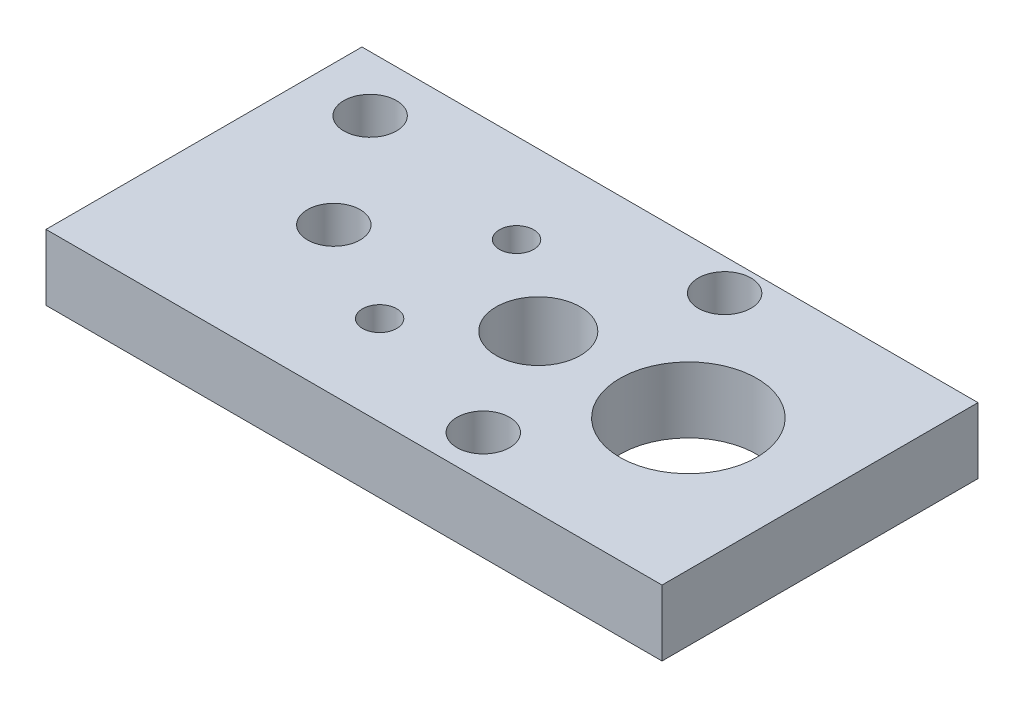
from build123d import *

# Parameters (mm, degrees)
SKETCH_1_W          = 23.395740059
SKETCH_1_H          = 12
SKETCH_1_R          = 0.65
SKETCH_1_R_2        = 1.6
SKETCH_1_R_3        = 2.6
EXTRUDE_1_DEPTH     = 2.5
SKETCH_3_R          = 0.7
CUT_EXTRUDE_1_DEPTH = 27.412320097
SKETCH_3_3_R        = 1
CUT_EXTRUDE_2_DEPTH = 1.5


with BuildPart() as part:
    # 草图1 → 凸台-拉伸1 (new body)
    with BuildSketch(Plane(origin=(0, 0, 0), x_dir=(1, 0, 0), z_dir=(0, 1, 0))):
        with Locations((11.69787003, -6)):
            Rectangle(SKETCH_1_W, SKETCH_1_H)
        with Locations((9.270831301, -3.4)):
            Circle(SKETCH_1_R, mode=Mode.SUBTRACT)
        with Locations((12.695740059, -6)):
            Circle(SKETCH_1_R_2, mode=Mode.SUBTRACT)
        with Locations((9.270831301, -8.6)):
            Circle(SKETCH_1_R, mode=Mode.SUBTRACT)
        with Locations((18.395740059, -6)):
            Circle(SKETCH_1_R_3, mode=Mode.SUBTRACT)
    extrude(amount=EXTRUDE_1_DEPTH)

    # 草图3 → 切除-拉伸1 (cut, through all)
    with BuildSketch(Plane(origin=(0, 2.5, 0), x_dir=(1, 0, 0), z_dir=(0, 1, 0))):
        with Locations((5.314681037, -6.384388153)):
            Circle(SKETCH_3_R)
        with Locations((2.419185522, -2.108925173)):
            Circle(SKETCH_3_R)
        with Locations((14.983521503, -1.209932246)):
            Circle(SKETCH_3_R)
        with Locations((14.983521503, -10.376111281)):
            Circle(SKETCH_3_R)
    extrude(amount=-CUT_EXTRUDE_1_DEPTH, mode=Mode.SUBTRACT)

    # 草图3<3> → 切除-拉伸2 (cut)
    with BuildSketch(Plane(origin=(0, 2.5, 0), x_dir=(1, 0, 0), z_dir=(0, 1, 0))):
        with Locations((2.419185522, -2.108925173)):
            Circle(SKETCH_3_3_R)
        with Locations((5.314681037, -6.384388153)):
            Circle(SKETCH_3_3_R)
        with Locations((14.983521503, -1.209932246)):
            Circle(SKETCH_3_3_R)
        with Locations((14.983521503, -10.376111281)):
            Circle(SKETCH_3_3_R)
    extrude(amount=-CUT_EXTRUDE_2_DEPTH, mode=Mode.SUBTRACT)


solid = part.part
